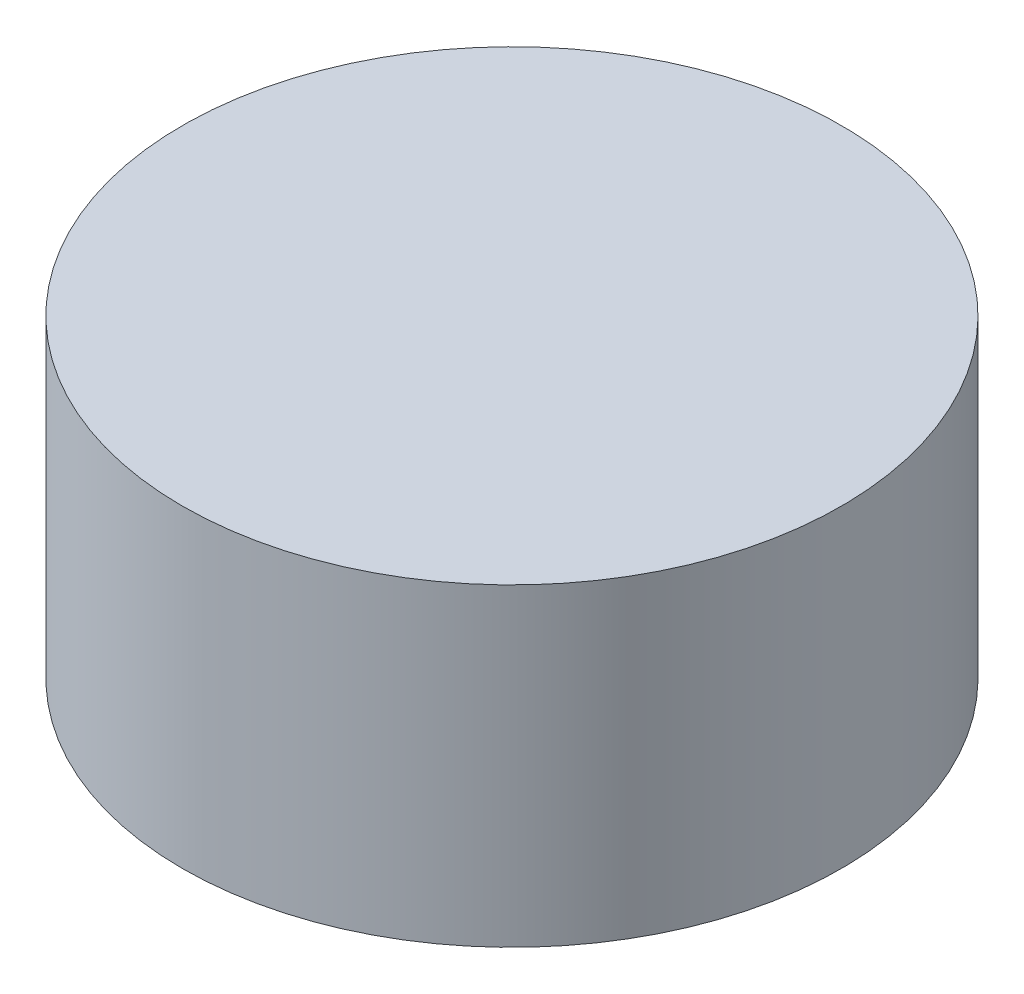
from build123d import *

# Parameters (mm, degrees)
SKETCH1_R           = 10.5
BOSS_EXTRUDE1_DEPTH = 10


with BuildPart() as part:
    # Sketch1 → Boss-Extrude1 (new body)
    with BuildSketch(Plane(origin=(0, 0, 0), x_dir=(1, 0, 0), z_dir=(0, 1, 0))):
        with Locations(Location((0, 0, 0), (0, 0, 270))):
            Circle(SKETCH1_R)
    extrude(amount=BOSS_EXTRUDE1_DEPTH)


solid = part.part
